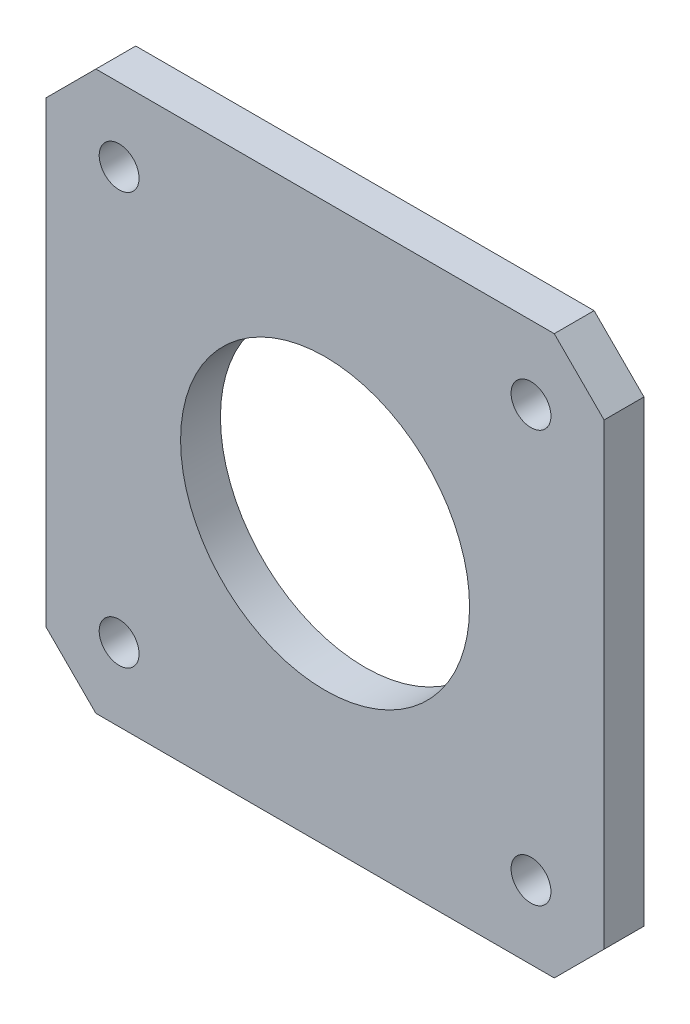
from build123d import *

# Parameters (mm, degrees)
SKETCH_1_R      = 1.5
SKETCH_1_R_2    = 10.875
EXTRUDE_1_DEPTH = 3


with BuildPart() as part:
    # Эскиз1 → Бобышка-Вытянуть1 (new body)
    with BuildSketch(Plane.XY):
        Polygon((17.25, 21), (21, 17.25), (21, -17.25), (17.25, -21), (-17.25, -21), (-21, -17.25), (-21, 17.25), (-17.25, 21), align=None)
        with Locations((-15.5, 15.5)):
            Circle(SKETCH_1_R, mode=Mode.SUBTRACT)
        with Locations((15.5, 15.5)):
            Circle(SKETCH_1_R, mode=Mode.SUBTRACT)
        with Locations((15.5, -15.5)):
            Circle(SKETCH_1_R, mode=Mode.SUBTRACT)
        with Locations((-15.5, -15.5)):
            Circle(SKETCH_1_R, mode=Mode.SUBTRACT)
        Circle(SKETCH_1_R_2, mode=Mode.SUBTRACT)
    extrude(amount=EXTRUDE_1_DEPTH)


solid = part.part
